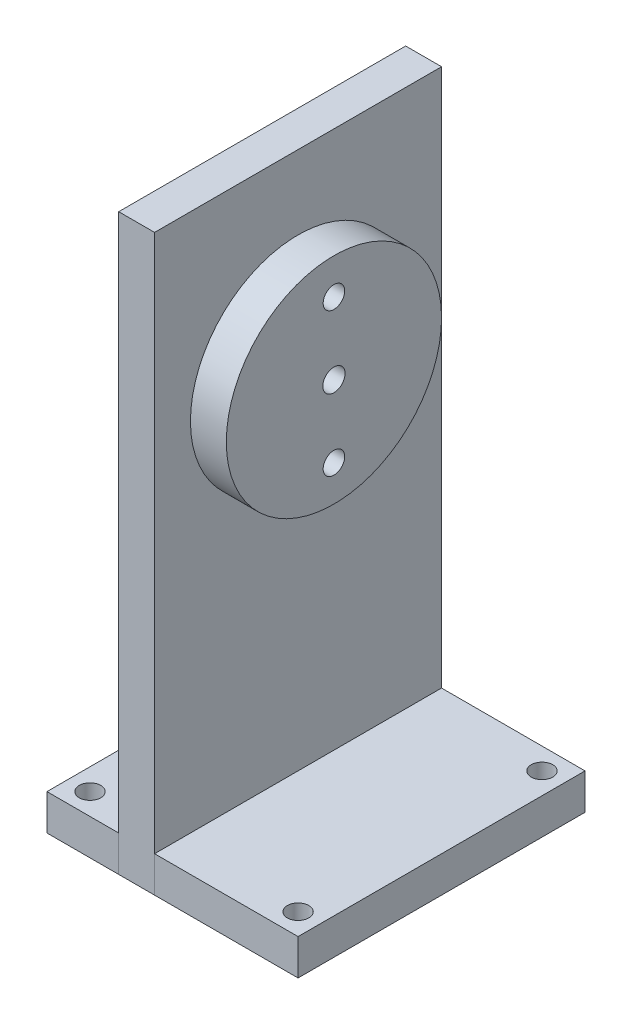
from build123d import *

# Parameters (mm, degrees)
SKETCH1_R                = 1.2
BOSS_EXTRUDE1_DEPTH      = 5
SKETCH4_R                = 1.5
SKETCH4_W                = 5
SKETCH4_H                = 14
BOSS_EXTRUDE2_DEPTH      = 5
BOSS_EXTRUDE3_DEPTH      = 5
BOSS_EXTRUDE3_DEPTH_BACK = 5
SKETCH10_R               = 15
SKETCH10_R_2             = 1.55
SKETCH10_R_3             = 1.5
BOSS_EXTRUDE5_DEPTH      = 5
SKETCH12_W               = 17.806233138
SKETCH12_H               = 10
BOSS_EXTRUDE6_DEPTH      = 2


with BuildPart() as part:
    # Sketch1 → Boss-Extrude1 (new body)
    with BuildSketch(Plane(origin=(0, 0, 0), x_dir=(0, 0, -1), z_dir=(1, 0, 0))):
        Polygon((0, 0), (-20, 0), (-20, 80), (20, 80), (20, 0), align=None)
        with Locations((0, 54.7)):
            Circle(SKETCH1_R, mode=Mode.SUBTRACT)
    extrude(amount=BOSS_EXTRUDE1_DEPTH)


with BuildPart() as body_2:
    # Sketch4 → Boss-Extrude2 (new body)
    with BuildSketch(Plane.XZ):
        Polygon((5, 20), (25, 20), (25, -20), (5, -20), (-10, -20), (-10, 20), align=None)
        with Locations(Location((-7, 17, 0), (0, 0, 270))):
            Circle(SKETCH4_R, mode=Mode.SUBTRACT)
        with Locations(Location((-7, -17, 0), (0, 0, 90))):
            Circle(SKETCH4_R, mode=Mode.SUBTRACT)
        with Locations(Location((22, -17, 0), (0, 0, 270))):
            Circle(SKETCH4_R, mode=Mode.SUBTRACT)
        with Locations(Location((22, 17, 0), (0, 0, 90))):
            Circle(SKETCH4_R, mode=Mode.SUBTRACT)
        with Locations((2.5, 0)):
            Rectangle(SKETCH4_W, SKETCH4_H, mode=Mode.SUBTRACT)
    extrude(amount=-BOSS_EXTRUDE2_DEPTH)


with BuildPart() as body_3:
    # Sketch8 → Boss-Extrude3 (new, two sides: drawn at the far end of the back side and taken through both)
    with BuildSketch(Plane(origin=(0, 54.7, 0), x_dir=(1, 0, 0), z_dir=(0, 1, 0)).offset(-BOSS_EXTRUDE3_DEPTH_BACK)):
        Polygon((-14.031503195, 4.978859287), (0, 4.978859287), (0, 0), (2.078626706, 0), (2.078626706, 9.227659687), (0, 9.227659687), (0, 15.941471051), align=None)
    extrude(amount=BOSS_EXTRUDE3_DEPTH + BOSS_EXTRUDE3_DEPTH_BACK)


with BuildPart() as body_4:
    # Sketch10 → Boss-Extrude5 (new body)
    with BuildSketch(Plane(origin=(5, 0, 0), x_dir=(0, 0, -1), z_dir=(1, 0, 0))):
        with Locations((0, 54.7)):
            Circle(SKETCH10_R)
        with Locations((0, 54.7)):
            Circle(SKETCH10_R_2, mode=Mode.SUBTRACT)
        with Locations((0, 64.7)):
            Circle(SKETCH10_R_3, mode=Mode.SUBTRACT)
        with Locations(Location((0, 44.7, 0), (0, 0, 180))):
            Circle(SKETCH10_R_3, mode=Mode.SUBTRACT)
    extrude(amount=BOSS_EXTRUDE5_DEPTH)


with BuildPart() as body_5:
    # Sketch12 → Boss-Extrude6 (new body)
    with BuildSketch(Plane(origin=(-7.733970616, 0, -9.899030973), x_dir=(-0.7880107536067256, 0, 0.6156614753256539), z_dir=(-0.6156614753256537, 0, -0.7880107536067255))):
        with Locations((-0.911433017, 54.7)):
            Rectangle(SKETCH12_W, SKETCH12_H)
    extrude(amount=BOSS_EXTRUDE6_DEPTH)


solid = Compound([part.part, body_2.part, body_3.part, body_4.part, body_5.part])
